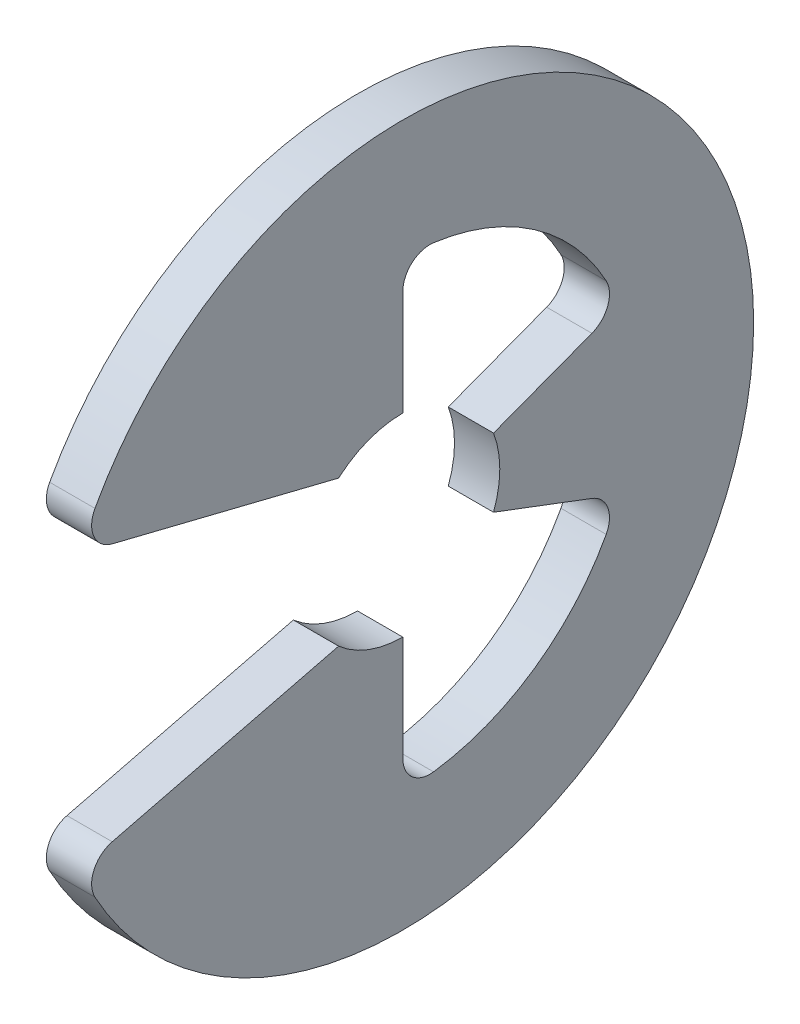
from build123d import *

# Parameters (mm, degrees)
EXTRUDE1_DEPTH = 0.35
FILLET1_R      = 0.42


with BuildPart() as part:
    # Sketch1 → Extrude1 (new, symmetric)
    with BuildSketch(Plane(origin=(0, 0, 0), x_dir=(0, 0, -1), z_dir=(1, 0, 0))):
        with BuildLine():
            Line((-4.994219972, -2.118582514), (-0.992156742, -1.125))
            ThreePointArc((-0.992156742, -1.125), (-0.530330086, -1.40312152), (0, -1.5))
            Line((0, -1.5), (0, -3.574193548))
            ThreePointArc((0, -3.574193548), (2.032026651, -2.940361748), (3.343351923, -1.263668248))
            Line((3.343351923, -1.263668248), (1.40312152, -0.530330086))
            ThreePointArc((1.40312152, -0.530330086), (1.5, 0), (1.40312152, 0.530330086))
            Line((1.40312152, 0.530330086), (3.343351923, 1.263668248))
            ThreePointArc((3.343351923, 1.263668248), (2.032026651, 2.940361748), (0, 3.574193548))
            Line((0, 3.574193548), (0, 1.5))
            ThreePointArc((0, 1.5), (-0.530330086, 1.40312152), (-0.992156742, 1.125))
            Line((-0.992156742, 1.125), (-4.994219972, 2.118582514))
            ThreePointArc((-4.994219972, 2.118582514), (5.425, 0), (-4.994219972, -2.118582514))
        make_face()
    extrude(amount=EXTRUDE1_DEPTH, both=True)

    # Fillet1
    fillet1_edges = [part.edges().sort_by_distance(p)[0] for p in [
        (0, -2.118582514, 4.994219972),
        (0, -3.574193548, 0),
        (0, -1.263668248, -3.343351923),
        (0, 1.263668248, -3.343351923),
        (0, 3.574193548, 0),
        (0, 2.118582514, 4.994219972),
    ]]
    fillet(fillet1_edges, radius=FILLET1_R)


solid = part.part
